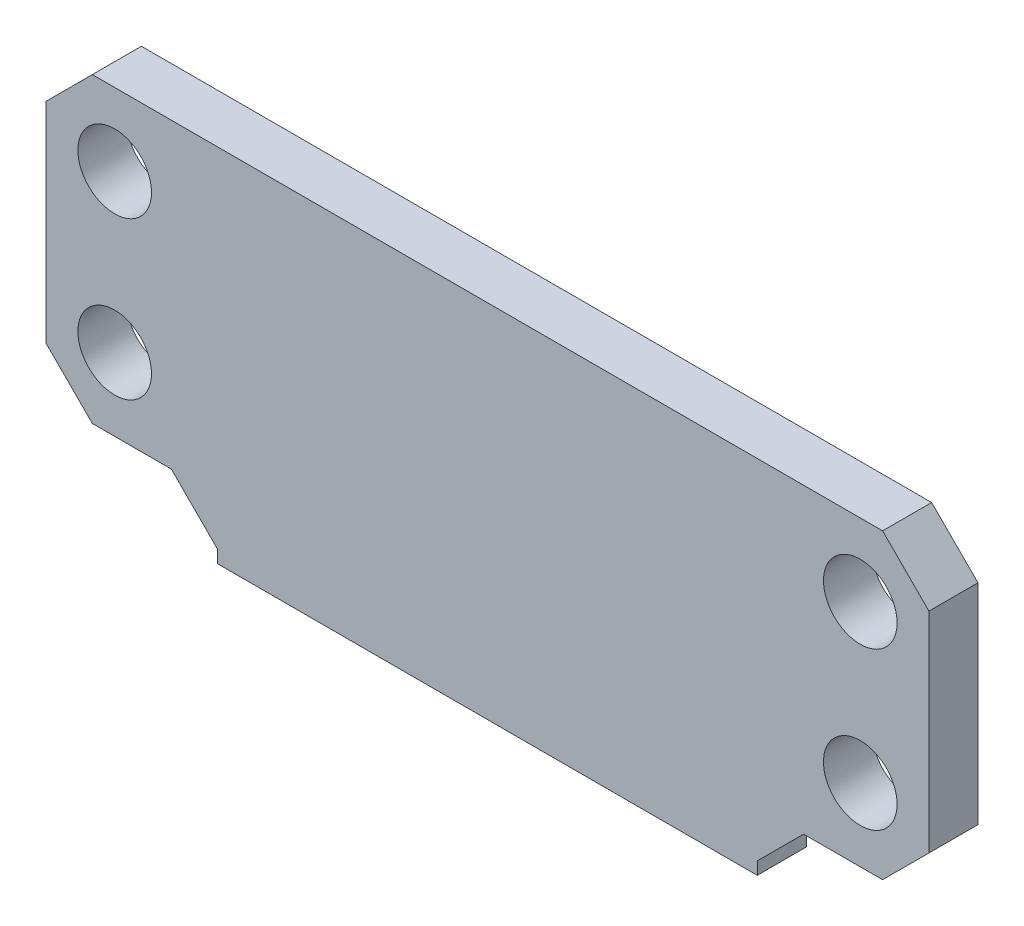
from build123d import *

# Parameters (mm, degrees)
SKETCH1_R           = 3.475
SKETCH1_R_2         = 2.3828
BOSS_EXTRUDE1_DEPTH = 3.175
CHAMFER1_SIZE       = 3
CHAMFER2_SIZE       = 3
SKETCH2_W           = 36.09329734
SKETCH2_H           = 19.05
CUT_EXTRUDE1_DEPTH  = 36.727201556


with BuildPart() as part:
    # Sketch1 → Boss-Extrude1 (new body)
    with BuildSketch(Plane.XY):
        Polygon((17.4625, -21.209), (-17.4625, -21.209), (-17.4625, 1.651), (-28.575, 1.651), (-28.575, 21.209), (28.575, 21.209), (28.575, 1.651), (17.4625, 1.651), align=None)
        with Locations((-9.525, -10.541)):
            Circle(SKETCH1_R, mode=Mode.SUBTRACT)
        with Locations((9.525, -10.541)):
            Circle(SKETCH1_R, mode=Mode.SUBTRACT)
        with Locations((-24.13, 6.35)):
            Circle(SKETCH1_R_2, mode=Mode.SUBTRACT)
        with Locations((-24.13, 16.51)):
            Circle(SKETCH1_R_2, mode=Mode.SUBTRACT)
        with Locations((24.13, 16.51)):
            Circle(SKETCH1_R_2, mode=Mode.SUBTRACT)
        with Locations((24.13, 6.35)):
            Circle(SKETCH1_R_2, mode=Mode.SUBTRACT)
    extrude(amount=BOSS_EXTRUDE1_DEPTH)

    # Chamfer1
    chamfer1_edges = [part.edges().sort_by_distance(p)[0] for p in [
        (-28.575, 1.651, 1.5875),
        (-28.575, 21.209, 1.5875),
        (28.575, 21.209, 1.5875),
        (28.575, 1.651, 1.5875),
    ]]
    chamfer(chamfer1_edges, length=CHAMFER1_SIZE)

    # Chamfer2
    chamfer2_edges = [part.edges().sort_by_distance(p)[0] for p in [
        (17.4625, 1.651, 1.5875),
        (17.4625, -21.209, 1.5875),
        (-17.4625, -21.209, 1.5875),
        (-17.4625, 1.651, 1.5875),
    ]]
    chamfer(chamfer2_edges, length=CHAMFER2_SIZE)

    # Sketch2 → Cut-Extrude1 (cut, through all)
    with BuildSketch(Plane(origin=(0, 0, 0), x_dir=(-1, 0, 0), z_dir=(0, 0, -1))):
        with Locations((0.32904128, -11.684)):
            Rectangle(SKETCH2_W, SKETCH2_H)
    extrude(amount=-CUT_EXTRUDE1_DEPTH, mode=Mode.SUBTRACT)


solid = part.part
